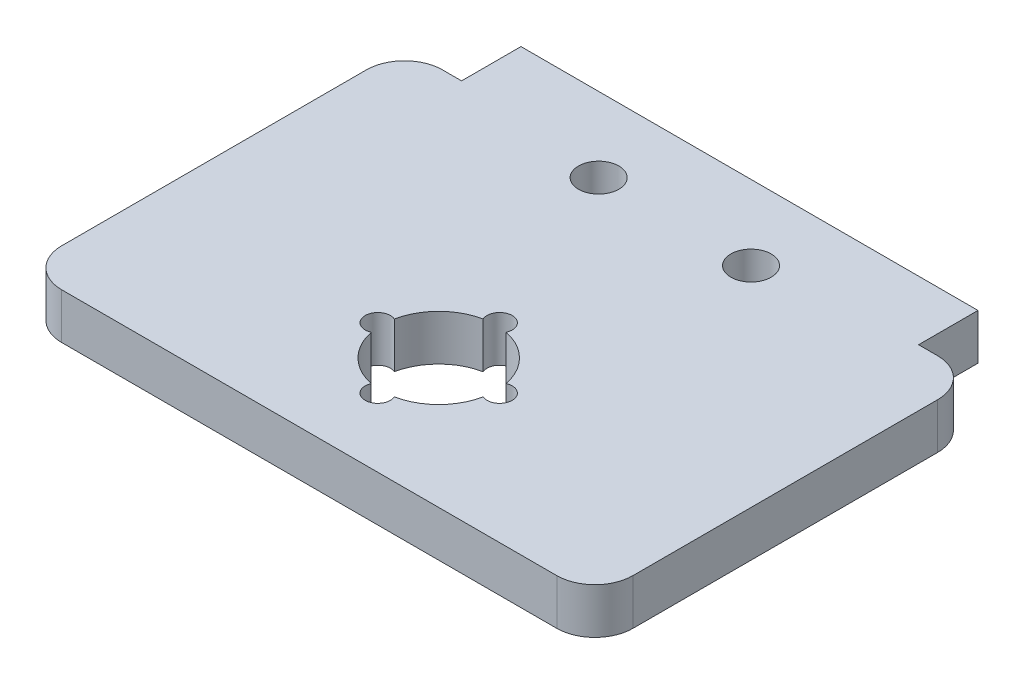
from build123d import *

# Parameters (mm, degrees)
EXTRUDE_1_DEPTH     = 6
SKETCH_2_W          = 60
SKETCH_2_H          = 2
CUT_EXTRUDE_1_DEPTH = 10


with BuildPart() as part:
    # 草图1 → 凸台-拉伸1 (new body)
    with BuildSketch(Plane(origin=(0, 0, 0), x_dir=(1, 0, 0), z_dir=(0, 1, 0))):
        with BuildLine():
            ThreePointArc((-32.5, 33), (-36.035533906, 31.535533906), (-37.5, 28))
            Line((-37.5, 28), (-37.5, 13))
            Line((-37.5, 13), (-37.5, -12))
            ThreePointArc((-37.5, -12), (-36.035533906, -15.535533906), (-32.5, -17))
            Line((-32.5, -17), (32.5, -17))
            ThreePointArc((32.5, -17), (36.035533906, -15.535533906), (37.5, -12))
            Line((37.5, -12), (37.5, 13))
            Line((37.5, 13), (37.5, 28))
            ThreePointArc((37.5, 28), (36.035533906, 31.535533906), (32.5, 33))
            Line((32.5, 33), (30, 33))
            Line((30, 33), (30, 42.800232859))
            Line((30, 42.800232859), (-30, 42.800232859))
            Line((-30, 42.800232859), (-30, 33))
            Line((-30, 33), (-32.5, 33))
        make_face()
        with BuildLine():
            ThreePointArc((1.514624984, 7.34546875), (5.303300859, 5.303300859), (7.34546875, 1.514624984))
            ThreePointArc((7.34546875, 1.514624984), (8.906234914, 1.378853974), (9.65, 0))
            ThreePointArc((9.65, 0), (8.906234914, -1.378853974), (7.34546875, -1.514624984))
            ThreePointArc((7.34546875, -1.514624984), (5.303300859, -5.303300859), (1.514624984, -7.34546875))
            ThreePointArc((1.514624984, -7.34546875), (1.615801848, -7.665807858), (1.65, -8))
            ThreePointArc((1.65, -8), (-0.334192142, -9.615801848), (-1.514624984, -7.34546875))
            ThreePointArc((-1.514624984, -7.34546875), (-5.303300859, -5.303300859), (-7.34546875, -1.514624984))
            ThreePointArc((-7.34546875, -1.514624984), (-9.65, 0), (-7.34546875, 1.514624984))
            ThreePointArc((-7.34546875, 1.514624984), (-5.303300859, 5.303300859), (-1.514624984, 7.34546875))
            ThreePointArc((-1.514624984, 7.34546875), (-0.334192142, 9.615801848), (1.65, 8))
            ThreePointArc((1.65, 8), (1.615801848, 7.665807858), (1.514624984, 7.34546875))
        make_face(mode=Mode.SUBTRACT)
        with BuildLine():
            ThreePointArc((-7.35, 31), (-11.098950694, 28.588608831), (-11.738533865, 33))
            ThreePointArc((-11.738533865, 33), (-10, 33.65), (-8.261466135, 33))
            ThreePointArc((-8.261466135, 33), (-7.588608831, 32.098950694), (-7.35, 31))
        make_face(mode=Mode.SUBTRACT)
        with BuildLine():
            ThreePointArc((12.65, 31), (8.901049306, 28.588608831), (8.261466135, 33))
            ThreePointArc((8.261466135, 33), (10, 33.65), (11.738533865, 33))
            ThreePointArc((11.738533865, 33), (12.411391169, 32.098950694), (12.65, 31))
        make_face(mode=Mode.SUBTRACT)
    extrude(amount=EXTRUDE_1_DEPTH)

    # 草图2 → 切除-拉伸1 (cut)
    with BuildSketch(Plane(origin=(0, 6, 0), x_dir=(1, 0, 0), z_dir=(0, 1, 0))):
        with Locations((0, 41.800232859)):
            Rectangle(SKETCH_2_W, SKETCH_2_H)
    extrude(amount=-CUT_EXTRUDE_1_DEPTH, mode=Mode.SUBTRACT)


solid = part.part
